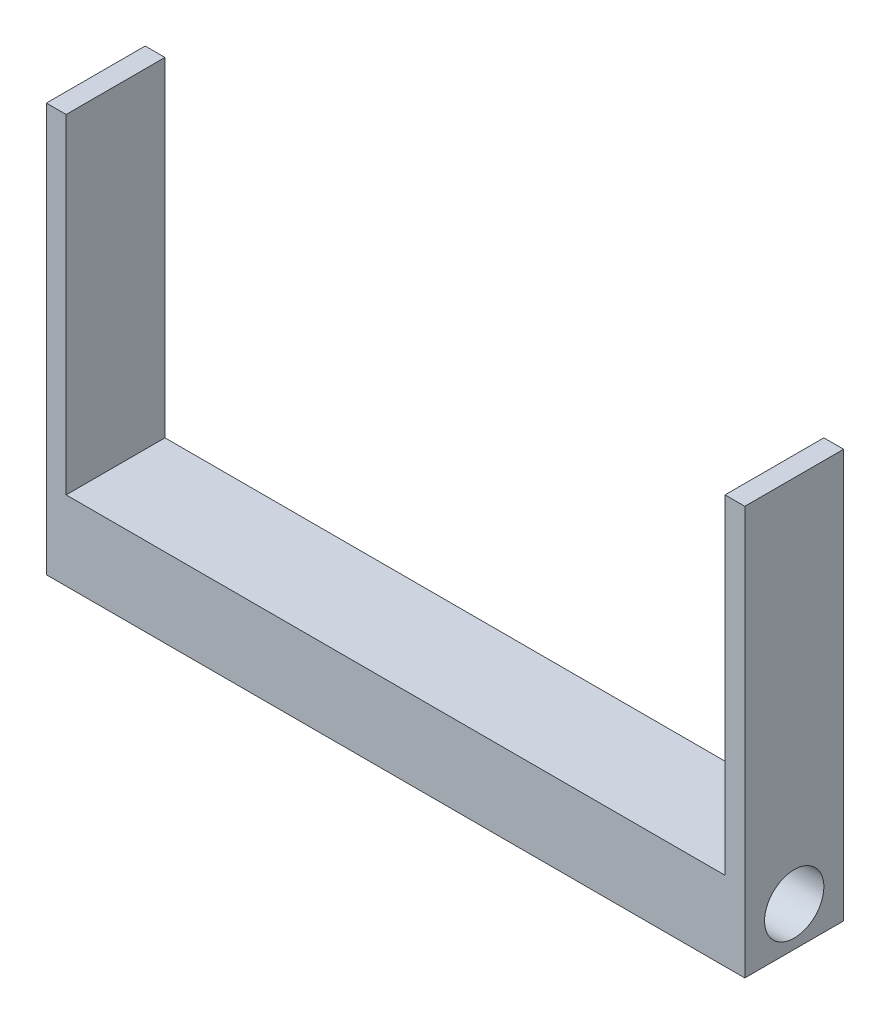
from build123d import *

# Parameters (mm, degrees)
EXTRUDE_THIN1_DEPTH = 7.5
SKETCH4_W           = 106
SKETCH4_H           = 15
BOSS_EXTRUDE1_DEPTH = 9
SKETCH5_R           = 4.5
CUT_EXTRUDE1_DEPTH  = 124.029468015


with BuildPart() as part:
    # Sketch1 → Extrude-Thin1 (new, symmetric)
    with BuildSketch(Plane.XY):
        Polygon((-50, 0), (-50, -50), (50, -50), (50, 0), (53, 0), (53, -53), (-53, -53), (-53, 0), align=None)
    extrude(amount=EXTRUDE_THIN1_DEPTH, both=True)

    # Sketch4 → Boss-Extrude1 (add)
    with BuildSketch(Plane.XZ.offset(53)):
        Rectangle(SKETCH4_W, SKETCH4_H)
    extrude(amount=BOSS_EXTRUDE1_DEPTH)

    # Sketch5 → Cut-Extrude1 (cut, through all)
    with BuildSketch(Plane(origin=(53, 0, 0), x_dir=(0, 0, -1), z_dir=(1, 0, 0))):
        with Locations(Location((0, -56, 0), (0, 0, 90))):
            Circle(SKETCH5_R)
    extrude(amount=-CUT_EXTRUDE1_DEPTH, mode=Mode.SUBTRACT)


solid = part.part
